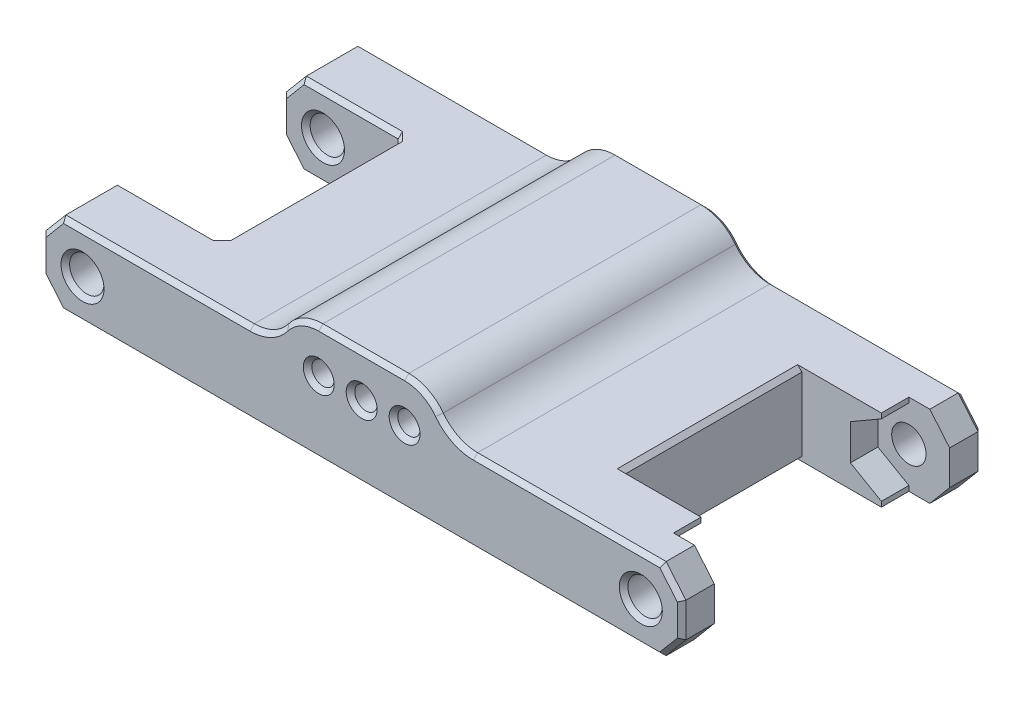
from build123d import *
from build123d.topology import SkipClean

# Parameters (mm, degrees)
BOSS_EXTRUDE1_DEPTH = 35
SKETCH2_W           = 14
SKETCH2_H           = 21
CUT_EXTRUDE1_DEPTH  = 35
BOSS_EXTRUDE2_DEPTH = 35
CUT_EXTRUDE2_DEPTH  = 58
FILLET1_R           = 5
CHAMFER2_SIZE       = 0.5
CHAMFER3_SIZE       = 0.5
CUT_EXTRUDE3_START  = -7
CUT_EXTRUDE3_DEPTH  = 3.2
CUT_EXTRUDE4_START  = -28
SKETCH4_3_R         = 2.5
CUT_EXTRUDE4_DEPTH  = 3.2


with BuildPart() as part:
    # Sketch1 → Boss-Extrude1 (new body)
    with BuildSketch(Plane.XY):
        with BuildLine():
            ThreePointArc((32.5, -4.75), (27.75, 0), (32.5, 4.75))
            Line((32.5, 4.75), (-32.5, 4.75))
            ThreePointArc((-32.5, 4.75), (-29.141242789, 3.358757211), (-27.75, 0))
            ThreePointArc((-27.75, 0), (-29.141242789, -3.358757211), (-32.5, -4.75))
            Line((-32.5, -4.75), (32.5, -4.75))
        make_face()
        with BuildLine():
            ThreePointArc((-27.75, 0), (-29.141242789, 3.358757211), (-32.5, 4.75))
            Line((-32.5, 4.75), (-32.5, 2))
            ThreePointArc((-32.5, 2), (-31.085786438, 1.414213562), (-30.5, 0))
            ThreePointArc((-30.5, 0), (-31.085786438, -1.414213562), (-32.5, -2))
            Line((-32.5, -2), (-32.5, -4.75))
            ThreePointArc((-32.5, -4.75), (-29.141242789, -3.358757211), (-27.75, 0))
        make_face()
        with BuildLine():
            Line((-32.5, 2), (-32.5, 4.75))
            ThreePointArc((-32.5, 4.75), (-35.858757211, 3.358757211), (-37.25, 0))
            ThreePointArc((-37.25, 0), (-35.858757211, -3.358757211), (-32.5, -4.75))
            Line((-32.5, -4.75), (-32.5, -2))
            ThreePointArc((-32.5, -2), (-34.5, 0), (-32.5, 2))
        make_face()
        with BuildLine():
            ThreePointArc((32.5, -4.75), (35.858757211, -3.358757211), (37.25, 0))
            ThreePointArc((37.25, 0), (35.858757211, 3.358757211), (32.5, 4.75))
            Line((32.5, 4.75), (32.5, 2))
            ThreePointArc((32.5, 2), (33.914213562, 1.414213562), (34.5, 0))
            ThreePointArc((34.5, 0), (33.914213562, -1.414213562), (32.5, -2))
            Line((32.5, -2), (32.5, -4.75))
        make_face()
        with BuildLine():
            Line((32.5, 2), (32.5, 4.75))
            ThreePointArc((32.5, 4.75), (27.75, 0), (32.5, -4.75))
            Line((32.5, -4.75), (32.5, -2))
            ThreePointArc((32.5, -2), (30.5, 0), (32.5, 2))
        make_face()
        with BuildLine():
            ThreePointArc((-37.25, 0), (-35.858757211, 3.358757211), (-32.5, 4.75))
            Line((-32.5, 4.75), (-34.942476014, 4.75))
            Line((-34.942476014, 4.75), (-37.25, 2))
            Line((-37.25, 2), (-37.25, 0))
        make_face()
        with BuildLine():
            Line((-34.942476014, -4.75), (-32.5, -4.75))
            ThreePointArc((-32.5, -4.75), (-35.858757211, -3.358757211), (-37.25, 0))
            Line((-37.25, 0), (-37.25, -2))
            Line((-37.25, -2), (-34.942476014, -4.75))
        make_face()
        with BuildLine():
            Line((37.25, 0), (37.25, 2))
            Line((37.25, 2), (34.942476014, 4.75))
            Line((34.942476014, 4.75), (32.5, 4.75))
            ThreePointArc((32.5, 4.75), (35.858757211, 3.358757211), (37.25, 0))
        make_face()
        with BuildLine():
            Line((37.25, -2), (37.25, 0))
            ThreePointArc((37.25, 0), (35.858757211, -3.358757211), (32.5, -4.75))
            Line((32.5, -4.75), (34.942476014, -4.75))
            Line((34.942476014, -4.75), (37.25, -2))
        make_face()
    extrude(amount=BOSS_EXTRUDE1_DEPTH)

    # Sketch2 → Cut-Extrude1 (cut)
    with BuildSketch(Plane(origin=(0, 4.75, 0), x_dir=(1, 0, 0), z_dir=(0, 1, 0))):
        with Locations((30.25, -17.5)):
            Rectangle(SKETCH2_W, SKETCH2_H)
        with Locations((-30.25, -17.5)):
            Rectangle(SKETCH2_W, SKETCH2_H)
    extrude(amount=-CUT_EXTRUDE1_DEPTH, mode=Mode.SUBTRACT)

    # Sketch3 → Boss-Extrude2 (add)
    with BuildSketch(Plane(origin=(0, 0, 0), x_dir=(-1, 0, 0), z_dir=(0, 0, -1))):
        with BuildLine():
            ThreePointArc((-5, 8.75), (-8.16227766, 7.622983346), (-9.898979486, 4.75))
            Line((-9.898979486, 4.75), (-5.830662386, 4.75))
            ThreePointArc((-5.830662386, 4.75), (-5, 5.05), (-4.169337614, 4.75))
            Line((-4.169337614, 4.75), (4.169337614, 4.75))
            ThreePointArc((4.169337614, 4.75), (5, 5.05), (5.830662386, 4.75))
            Line((5.830662386, 4.75), (9.898979486, 4.75))
            ThreePointArc((9.898979486, 4.75), (8.16227766, 7.622983346), (5, 8.75))
            Line((5, 8.75), (-5, 8.75))
        make_face()
    extrude(amount=-BOSS_EXTRUDE2_DEPTH)

    # Sketch3<2> → Cut-Extrude2 (cut)
    with SkipClean():  # the faces are left unmerged after this step: merging them gives an invalid solid
        with BuildSketch(Plane(origin=(0, 0, 0), x_dir=(-1, 0, 0), z_dir=(0, 0, -1))):
            with BuildLine():
                Line((0.830662386, 4.75), (-0.830662386, 4.75))
                ThreePointArc((-0.830662386, 4.75), (-0.552330923, 2.573169277), (1.3, 3.75))
                ThreePointArc((1.3, 3.75), (1.176830723, 4.302330923), (0.830662386, 4.75))
            make_face()
            with BuildLine():
                ThreePointArc((0.830662386, 4.75), (0, 5.05), (-0.830662386, 4.75))
                Line((-0.830662386, 4.75), (0.830662386, 4.75))
            make_face()
            with BuildLine():
                Line((-4.169337614, 4.75), (-5.830662386, 4.75))
                ThreePointArc((-5.830662386, 4.75), (-5.552330923, 2.573169277), (-3.7, 3.75))
                ThreePointArc((-3.7, 3.75), (-3.823169277, 4.302330923), (-4.169337614, 4.75))
            make_face()
            with BuildLine():
                ThreePointArc((-4.169337614, 4.75), (-5, 5.05), (-5.830662386, 4.75))
                Line((-5.830662386, 4.75), (-4.169337614, 4.75))
            make_face()
            with BuildLine():
                Line((4.169337614, 4.75), (5.830662386, 4.75))
                ThreePointArc((5.830662386, 4.75), (5, 5.05), (4.169337614, 4.75))
            make_face()
            with BuildLine():
                ThreePointArc((6.3, 3.75), (6.176830723, 4.302330923), (5.830662386, 4.75))
                Line((5.830662386, 4.75), (4.169337614, 4.75))
                ThreePointArc((4.169337614, 4.75), (4.447669077, 2.573169277), (6.3, 3.75))
            make_face()
        extrude(amount=-CUT_EXTRUDE2_DEPTH, mode=Mode.SUBTRACT)

    # Fillet1
    fillet1_edges = [part.edges().sort_by_distance(p)[0] for p in [
        (-9.898979486, 4.75, 17.5),
        (9.898979486, 4.75, 17.5),
    ]]
    fillet(fillet1_edges, radius=FILLET1_R)

    # Chamfer2
    chamfer2_edges = [part.edges().sort_by_distance(p)[0] for p in [
        (-6.176830723, 4.302330923, 0),
        (3.823169277, 4.302330923, 0),
        (7.236067977, 8.222135955, 35),
        (0, 8.75, 0),
        (7.236067977, 8.222135955, 0),
        (-4.447669077, 2.573169277, 35),
        (5.552330923, 2.573169277, 35),
        (0, 8.75, 35),
        (-23.971238007, 4.75, 35),
        (-32.5, -2, 0),
        (36.096238007, 3.375, 0),
        (37.25, 0, 0),
        (1.3, 3.75, 35),
        (1.3, 3.75, 0),
        (36.096238007, -3.375, 0),
        (0, -4.75, 0),
        (23.971238007, 4.75, 35),
        (23.971238007, 4.75, 0),
        (-7.236067977, 8.222135955, 35),
        (-7.236067977, 8.222135955, 0),
        (10.763932023, 5.277864045, 0),
        (10.763932023, 5.277864045, 35),
        (-10.763932023, 5.277864045, 0),
        (-10.763932023, 5.277864045, 35),
        (-36.096238007, -3.375, 0),
        (-37.25, 0, 0),
        (-36.096238007, 3.375, 0),
        (-23.971238007, 4.75, 0),
        (32.5, -2, 0),
        (-36.096238007, 3.375, 35),
        (-37.25, 0, 35),
        (-36.096238007, -3.375, 35),
        (0, -4.75, 35),
        (-23.25, -4.75, 17.5),
        (36.096238007, -3.375, 35),
        (37.25, 0, 35),
        (36.096238007, 3.375, 35),
        (-32.5, -2, 35),
        (32.5, -2, 35),
        (-37.25, 0, 28),
        (-23.25, 0, 7),
        (-36.096238007, 3.375, 7),
        (-29.096238007, -4.75, 7),
        (-36.096238007, -3.375, 7),
        (-37.25, 0, 7),
        (-32.5, -2, 7),
        (-36.096238007, 3.375, 28),
        (-36.096238007, -3.375, 28),
        (-29.096238007, -4.75, 28),
        (-23.25, 0, 28),
        (-32.5, -2, 28),
        (-29.096238007, 4.75, 7),
        (-29.096238007, 4.75, 28),
        (-23.25, 4.75, 17.5),
    ]]
    chamfer(chamfer2_edges, length=CHAMFER2_SIZE)

    # Chamfer3
    chamfer3_edges = [part.edges().sort_by_distance(p)[0] for p in [
        (23.25, -4.75, 17.5),
        (23.25, 4.75, 17.5),
    ]]
    chamfer(chamfer3_edges, length=CHAMFER3_SIZE)

    # Sketch4 → Cut-Extrude3 (cut)
    with SkipClean():  # the faces are left unmerged after this step: merging them gives an invalid solid
        with BuildSketch(Plane(origin=(0, 0, 0), x_dir=(-1, 0, 0), z_dir=(0, 0, -1)).offset(CUT_EXTRUDE3_START)):
            Polygon((-28.9, -2.078460969), (-28.9, 2.078460969), (-32.5, 4.156921938), (-32.5, 4.75), (-41.441027027, 4.75), (-41.441027027, -4.75), (-32.5, -4.75), (-32.5, -4.156921938), align=None)
        extrude(amount=CUT_EXTRUDE3_DEPTH, mode=Mode.SUBTRACT)

    # Sketch4<3> → Cut-Extrude4 (cut)
    # profile 1 of 3: a face of its own
    with SkipClean():  # the faces are left unmerged after this step: merging them gives an invalid solid
        with BuildSketch(Plane(origin=(0, 0, 0), x_dir=(-1, 0, 0), z_dir=(0, 0, -1)).offset(CUT_EXTRUDE4_START)):
            Polygon((-28.9, -2.078460969), (-28.9, 2.078460969), (-32.5, 4.156921938), (-32.5, 4.25), (-34.709322185, 4.25), (-36.75, 1.818014883), (-36.75, -1.818014883), (-34.709322185, -4.25), (-32.5, -4.25), (-32.5, -4.156921938), align=None)
            with Locations((-32.5, 0)):
                Circle(SKETCH4_3_R, mode=Mode.SUBTRACT)
        # profile 2 of 3: a face of its own
        with BuildSketch(Plane(origin=(0, 0, 0), x_dir=(-1, 0, 0), z_dir=(0, 0, -1)).offset(CUT_EXTRUDE4_START)):
            with Locations((-32.5, 0)):
                Circle(SKETCH4_3_R)
        # profile 3 of 3: a face of its own
        with BuildSketch(Plane(origin=(0, 0, 0), x_dir=(-1, 0, 0), z_dir=(0, 0, -1)).offset(CUT_EXTRUDE4_START)):
            Polygon((-34.709322185, 4.25), (-32.5, 4.25), (-32.5, 4.75), (-41.441027027, 4.75), (-41.441027027, -4.75), (-32.5, -4.75), (-32.5, -4.25), (-34.709322185, -4.25), (-36.75, -1.818014883), (-36.75, 1.818014883), align=None)
        extrude(amount=-CUT_EXTRUDE4_DEPTH, mode=Mode.SUBTRACT)


solid = part.part
